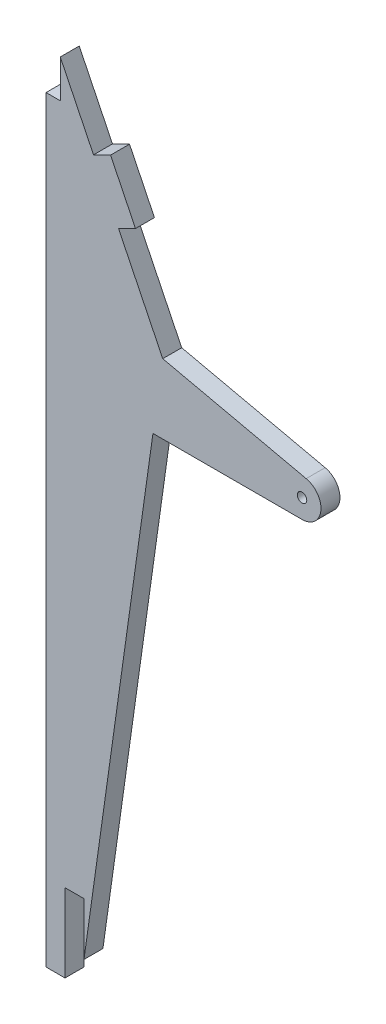
from build123d import *

# Parameters (mm, degrees)
SKETCH_1_R      = 0.5
EXTRUDE_1_DEPTH = 2


with BuildPart() as part:
    # 草图1 → 凸台-拉伸1 (new body)
    with BuildSketch(Plane.XY):
        with BuildLine():
            Line((12.204680674, 10.819505304), (12.204680674, 5.259215029))
            Line((12.204680674, 5.259215029), (19.479224798, 56.952222064))
            Line((19.479224798, 56.952222064), (35.204680674, 56.952222064))
            ThreePointArc((35.204680674, 56.952222064), (37.192550066, 58.73227825), (35.64190025, 60.903846783))
            Line((35.64190025, 60.903846783), (20.512305514, 64.293307336))
            Line((20.512305514, 64.293307336), (15.841876729, 73.869105416))
            Line((15.841876729, 73.869105416), (17.639464822, 74.74584771))
            Line((17.639464822, 74.74584771), (15.009237941, 80.138611987))
            Line((15.009237941, 80.138611987), (13.211649848, 79.261869694))
            Line((13.211649848, 79.261869694), (9.704680674, 86.452222064))
            Line((9.704680674, 86.452222064), (9.704680674, 82.452222064))
            Line((9.704680674, 82.452222064), (8.204680674, 82.452222064))
            Line((8.204680674, 82.452222064), (8.204680674, 2.569505304))
            Line((8.204680674, 2.569505304), (10.204680674, 2.569505304))
            Line((10.204680674, 2.569505304), (10.204680674, 10.819505304))
            Line((10.204680674, 10.819505304), (12.204680674, 10.819505304))
        make_face()
        with Locations((35.204680674, 58.952222064)):
            Circle(SKETCH_1_R, mode=Mode.SUBTRACT)
    extrude(amount=EXTRUDE_1_DEPTH)


solid = part.part
